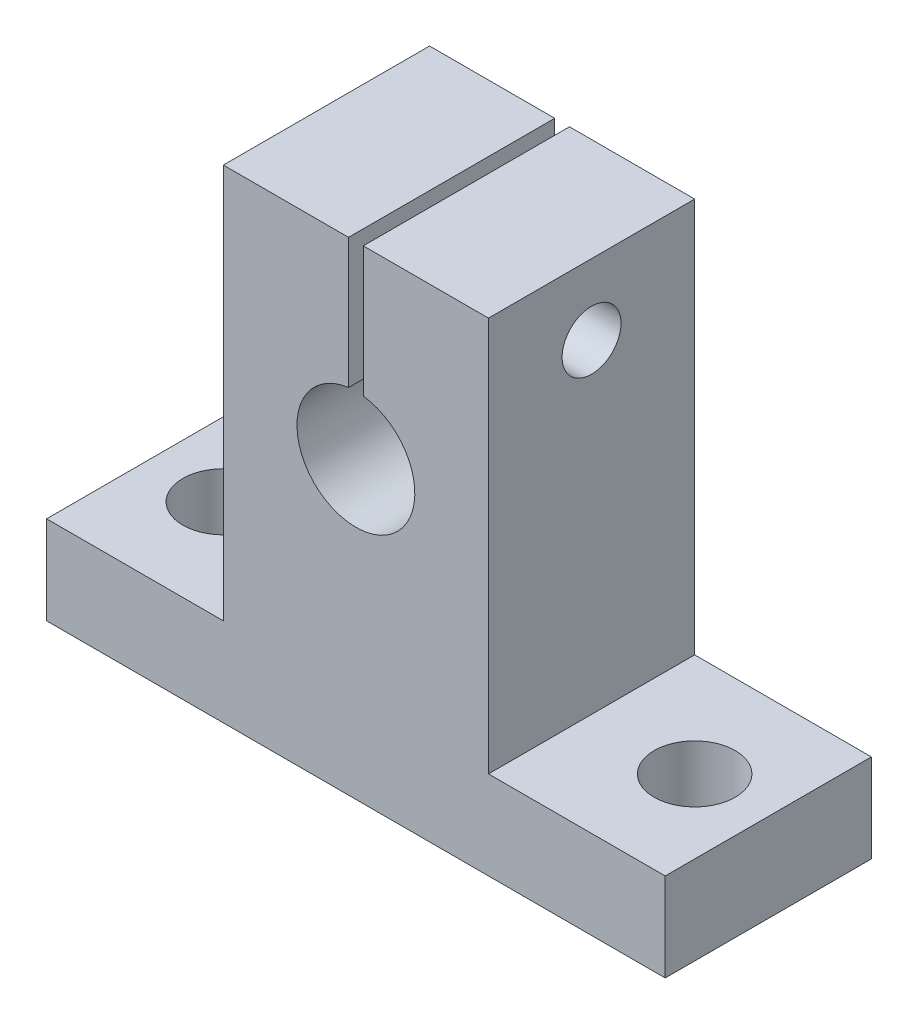
from build123d import *

# Parameters (mm, degrees)
BOSS_EXTRUDE1_DEPTH = 7
SKETCH2_R           = 2.75
CUT_EXTRUDE1_DEPTH  = 14
SKETCH3_R           = 2
CUT_EXTRUDE2_DEPTH  = 19


with BuildPart() as part:
    # Sketch1 → Boss-Extrude1 (new, symmetric)
    with BuildSketch(Plane.XY):
        with BuildLine():
            Line((0.5, 32.8), (9, 32.8))
            Line((9, 32.8), (9, 6))
            Line((9, 6), (21, 6))
            Line((21, 6), (21, 0))
            Line((21, 0), (-21, 0))
            Line((-21, 0), (-21, 6))
            Line((-21, 6), (-9, 6))
            Line((-9, 6), (-9, 32.8))
            Line((-9, 32.8), (-0.5, 32.8))
            Line((-0.5, 32.8), (-0.5, 23.968626967))
            ThreePointArc((-0.5, 23.968626967), (0, 16), (0.5, 23.968626967))
            Line((0.5, 23.968626967), (0.5, 32.8))
        make_face()
    extrude(amount=BOSS_EXTRUDE1_DEPTH, both=True)

    # Sketch2 → Cut-Extrude1 (cut)
    with BuildSketch(Plane(origin=(0, 6, 0), x_dir=(1, 0, 0), z_dir=(0, 1, 0))):
        with Locations(Location((-16, 0, 0), (0, 0, 270))):
            Circle(SKETCH2_R)
        with Locations(Location((16, 0, 0), (0, 0, 270))):
            Circle(SKETCH2_R)
    extrude(amount=-CUT_EXTRUDE1_DEPTH, mode=Mode.SUBTRACT)

    # Sketch3 → Cut-Extrude2 (cut)
    with BuildSketch(Plane(origin=(9, 0, 0), x_dir=(0, 0, -1), z_dir=(1, 0, 0))):
        with Locations((0, 28)):
            Circle(SKETCH3_R)
    extrude(amount=-CUT_EXTRUDE2_DEPTH, mode=Mode.SUBTRACT)


solid = part.part
